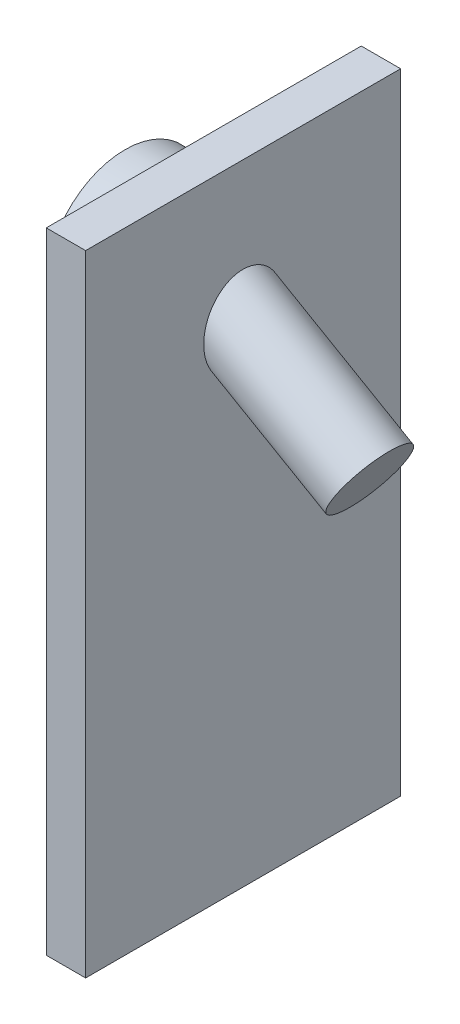
from build123d import *

# Parameters (mm, degrees)
SKETCH1_W           = 3.175
SKETCH1_H           = 50.8
BOSS_EXTRUDE1_DEPTH = 25.4
SKETCH2_R           = 6.35
BOSS_EXTRUDE2_DEPTH = 6.35


with BuildPart() as part:
    # Sketch1 → Boss-Extrude1 (new body)
    with BuildSketch(Plane.XY):
        with Locations((-1.5875, 25.4)):
            Rectangle(SKETCH1_W, SKETCH1_H)
    extrude(amount=BOSS_EXTRUDE1_DEPTH)

    # Sketch2 → Boss-Extrude2 (add)
    with BuildSketch(Plane.ZY.offset(3.175)):
        with Locations(Location((12.7, 40.386207141, 0), (0, 0, 180))):
            Circle(SKETCH2_R)
    extrude(amount=BOSS_EXTRUDE2_DEPTH)

    # Sketch5 → Revolve2 (revolve)
    with BuildSketch(Plane.XY.offset(12.7)):
        Polygon((0, 43.146240345), (11.795403193, 36.336161137), (10.207903193, 33.586530479), (0, 39.480066136), align=None)
    revolve(axis=Axis((10.207903193, 33.586530479, 12.7), (-0.8660254037844417, 0.4999999999999948, 0)))


solid = part.part
